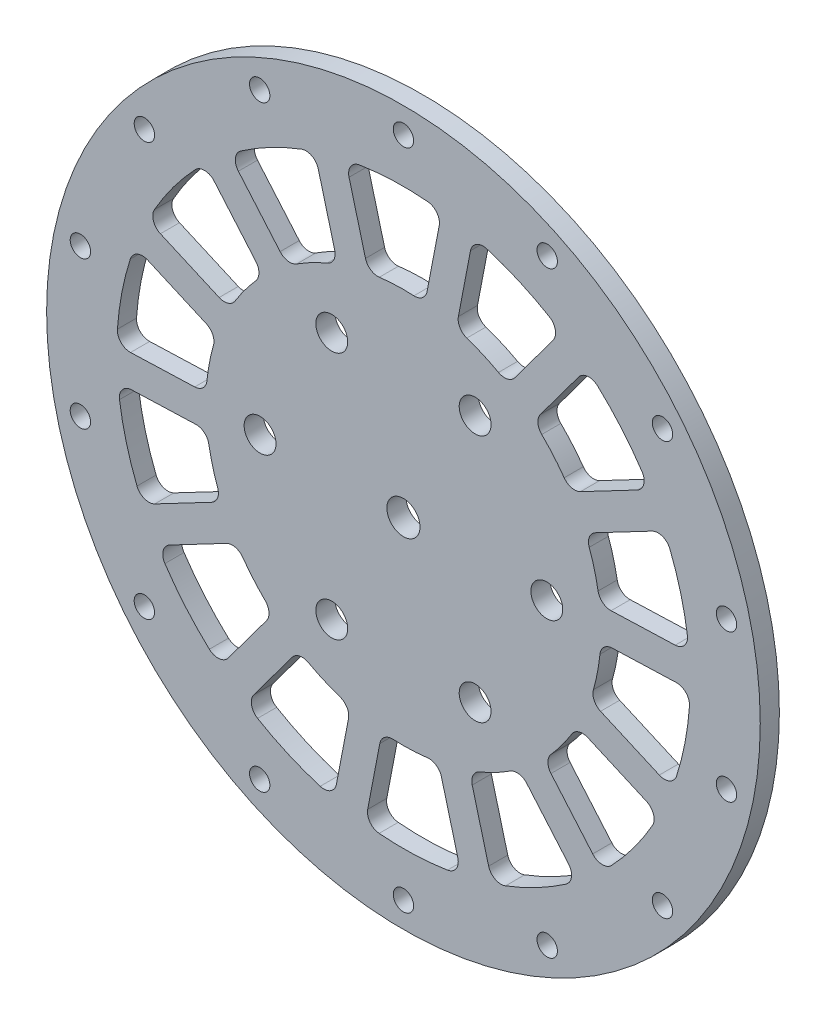
from build123d import *

# Parameters (mm, degrees)
SKETCH_1_R          = 56
SKETCH_1_R_2        = 1.6
SKETCH_1_R_3        = 2.6
SKETCH_1_R_4        = 2.5
EXTRUDE_1_DEPTH     = 3
SKETCH_2_R          = 45
SKETCH_2_R_2        = 31
CUT_EXTRUDE_1_DEPTH = 10
EXTRUDE_1_2_DEPTH   = 3
FILLET_2_R          = 2


with BuildPart() as part:
    # 草图1 → Extrude 1 (new body)
    with BuildSketch(Plane.XY):
        Circle(SKETCH_1_R)
        with Locations((0, 52)):
            Circle(SKETCH_1_R_2, mode=Mode.SUBTRACT)
        with Locations((22.561954434, 46.850381131)):
            Circle(SKETCH_1_R_2, mode=Mode.SUBTRACT)
        with Locations((40.655237088, 32.421469697)):
            Circle(SKETCH_1_R_2, mode=Mode.SUBTRACT)
        with Locations((50.696251433, 11.571088566)):
            Circle(SKETCH_1_R_2, mode=Mode.SUBTRACT)
        with Locations((50.696251433, -11.571088566)):
            Circle(SKETCH_1_R_2, mode=Mode.SUBTRACT)
        with Locations((40.655237088, -32.421469697)):
            Circle(SKETCH_1_R_2, mode=Mode.SUBTRACT)
        with Locations((22.561954434, -46.850381131)):
            Circle(SKETCH_1_R_2, mode=Mode.SUBTRACT)
        with Locations((0, -52)):
            Circle(SKETCH_1_R_2, mode=Mode.SUBTRACT)
        with Locations((-22.561954434, -46.850381131)):
            Circle(SKETCH_1_R_2, mode=Mode.SUBTRACT)
        with Locations((-40.655237088, -32.421469697)):
            Circle(SKETCH_1_R_2, mode=Mode.SUBTRACT)
        with Locations((-50.696251433, -11.571088566)):
            Circle(SKETCH_1_R_2, mode=Mode.SUBTRACT)
        with Locations((-50.696251433, 11.571088566)):
            Circle(SKETCH_1_R_2, mode=Mode.SUBTRACT)
        with Locations((-40.655237088, 32.421469697)):
            Circle(SKETCH_1_R_2, mode=Mode.SUBTRACT)
        with Locations((-22.561954434, 46.850381131)):
            Circle(SKETCH_1_R_2, mode=Mode.SUBTRACT)
        Circle(SKETCH_1_R_3, mode=Mode.SUBTRACT)
        with Locations((11.25, 19.485571585)):
            Circle(SKETCH_1_R_4, mode=Mode.SUBTRACT)
        with Locations((-11.25, 19.485571585)):
            Circle(SKETCH_1_R_4, mode=Mode.SUBTRACT)
        with Locations((-22.5, 0)):
            Circle(SKETCH_1_R_4, mode=Mode.SUBTRACT)
        with Locations((-11.25, -19.485571585)):
            Circle(SKETCH_1_R_4, mode=Mode.SUBTRACT)
        with Locations((11.25, -19.485571585)):
            Circle(SKETCH_1_R_4, mode=Mode.SUBTRACT)
        with Locations((22.5, 0)):
            Circle(SKETCH_1_R_4, mode=Mode.SUBTRACT)
    extrude(amount=EXTRUDE_1_DEPTH)

    # 草图2 → 切除-拉伸1 (cut)
    with BuildSketch(Plane.XY.offset(3)):
        Circle(SKETCH_2_R)
        Circle(SKETCH_2_R_2, mode=Mode.SUBTRACT)
    extrude(amount=-CUT_EXTRUDE_1_DEPTH, mode=Mode.SUBTRACT)


with BuildPart() as cut_extrude_1_piece_1:
    # of the separate pieces the step leaves, piece 1, a body of its own (cut_extrude_1_pieces)
    add(part.part.solids().sort_by_distance((56, 0, 0))[0])



with BuildPart() as cut_extrude_1_piece_2:
    # of the separate pieces the step leaves, piece 2, a body of its own (cut_extrude_1_pieces)
    add(part.part.solids().sort_by_distance((31, 0, 0))[0])


with BuildPart() as cut_extrude_1_piece_1_1:
    add(cut_extrude_1_piece_1.part)

    add(cut_extrude_1_piece_2.part)  # Extrude 1 2 merges 切除-拉伸1 piece 2
    # 草图3 → Extrude 1 2 (add)
    with BuildSketch(Plane.XY.offset(3)):
        Polygon((-14.609298387, 45.373678206), (-9.303630073, 25.350616171), (-4.470429278, 26.631307419), (-9.776097591, 46.654369454), align=None)
        Polygon((6.524378129, 47.219008495), (2.616939079, 26.876809755), (7.527173635, 25.933625467), (11.434612685, 46.275824207), align=None)
        Polygon((26.36582154, 39.71203505), (14.019191351, 23.079721546), (18.033927495, 20.099470936), (30.380557684, 36.731784439), align=None)
        Polygon((40.98519064, 24.339606026), (22.644770843, 14.71141143), (24.968840842, 10.284369682), (43.309260639, 19.912564278), align=None)
        Polygon((47.486940083, 4.146419523), (26.785275749, 3.429325856), (26.958369039, -1.567677117), (47.660033372, -0.85058345), align=None)
        Polygon((44.583318653, -16.868016219), (25.620628293, -8.531979761), (23.608461624, -13.109226236), (42.571151984, -21.445262694), align=None)
        Polygon((32.849424186, -34.541534476), (19.381501187, -18.803422148), (15.582608846, -22.054332325), (29.050531844, -37.792444653), align=None)
        Polygon((14.609298387, -45.373678206), (9.303630073, -25.350616171), (4.470429278, -26.631307419), (9.776097591, -46.654369454), align=None)
        Polygon((-6.524378129, -47.219008495), (-2.616939079, -26.876809755), (-7.527173635, -25.933625467), (-11.434612685, -46.275824207), align=None)
        Polygon((-26.36582154, -39.71203505), (-14.019191351, -23.079721546), (-18.033927495, -20.099470936), (-30.380557684, -36.731784439), align=None)
        Polygon((-40.98519064, -24.339606026), (-22.644770843, -14.71141143), (-24.968840842, -10.284369682), (-43.309260639, -19.912564278), align=None)
        Polygon((-47.486940083, -4.146419523), (-26.785275749, -3.429325856), (-26.958369039, 1.567677117), (-47.660033372, 0.85058345), align=None)
        Polygon((-44.583318653, 16.868016219), (-25.620628293, 8.531979761), (-23.608461624, 13.109226236), (-42.571151984, 21.445262694), align=None)
        Polygon((-32.849424186, 34.541534476), (-19.381501187, 18.803422148), (-15.582608846, 22.054332325), (-29.050531844, 37.792444653), align=None)
    extrude(amount=-EXTRUDE_1_2_DEPTH)

    # 圆角2
    fillet_2_edges = [cut_extrude_1_piece_1_1.edges().sort_by_distance(p)[0] for p in [
        (16.410002001, 26.300415098, 1.5),
        (20.424738144, 23.320164488, 1.5),
        (28.788199205, 34.586696669, 1.5),
        (24.773463062, 37.56694728, 1.5),
        (40.943876522, 18.670805429, 1.5),
        (28.520293368, 12.148780442, 1.5),
        (26.196223368, 16.57582219, 1.5),
        (38.619806522, 23.097847177, 1.5),
        (44.990116949, -0.943067809, 1.5),
        (30.967054712, -1.428818566, 1.5),
        (30.793961422, 3.568184407, 1.5),
        (44.817023659, 4.053935164, 1.5),
        (40.125512947, -20.370154902, 1.5),
        (27.280411084, -14.723422534, 1.5),
        (29.292577753, -10.146176058, 1.5),
        (42.137679616, -15.792908426, 1.5),
        (6.020431416, 44.595452745, 1.5),
        (10.930665972, 43.652268457, 1.5),
        (27.313558999, -35.762682992, 1.5),
        (18.190547469, -25.101872097, 1.5),
        (21.98943981, -21.85096192, 1.5),
        (31.11245134, -32.511772815, 1.5),
        (9.091819712, -44.071973116, 1.5),
        (5.497822835, -30.508588038, 1.5),
        (10.33102363, -29.22789679, 1.5),
        (13.925020507, -42.791281868, 1.5),
        (-10.930665972, -43.652268457, 1.5),
        (-8.283813038, -29.872703955, 1.5),
        (-3.373578481, -30.815888243, 1.5),
        (-6.020431416, -44.595452745, 1.5),
        (-28.788199205, -34.586696669, 1.5),
        (-20.424738144, -23.320164488, 1.5),
        (-16.410002001, -26.300415098, 1.5),
        (-24.773463062, -37.56694728, 1.5),
        (-40.943876522, -18.670805429, 1.5),
        (-28.520293368, -12.148780442, 1.5),
        (-26.196223368, -16.57582219, 1.5),
        (-38.619806522, -23.097847177, 1.5),
        (-44.990116949, 0.943067809, 1.5),
        (-30.967054712, 1.428818566, 1.5),
        (-30.793961422, -3.568184407, 1.5),
        (-44.817023659, -4.053935164, 1.5),
        (3.373578481, 30.815888243, 1.5),
        (-40.125512947, 20.370154902, 1.5),
        (-27.280411084, 14.723422534, 1.5),
        (-29.292577753, 10.146176058, 1.5),
        (-42.137679616, 15.792908426, 1.5),
        (-27.313558999, 35.762682992, 1.5),
        (-18.190547469, 25.101872097, 1.5),
        (-21.98943981, 21.85096192, 1.5),
        (-31.11245134, 32.511772815, 1.5),
        (8.283813038, 29.872703955, 1.5),
        (-10.33102363, 29.22789679, 1.5),
        (-5.497822835, 30.508588038, 1.5),
        (-9.091819712, 44.071973116, 1.5),
        (-13.925020507, 42.791281868, 1.5),
    ]]
    fillet(fillet_2_edges, radius=FILLET_2_R)


solid = cut_extrude_1_piece_1_1.part
